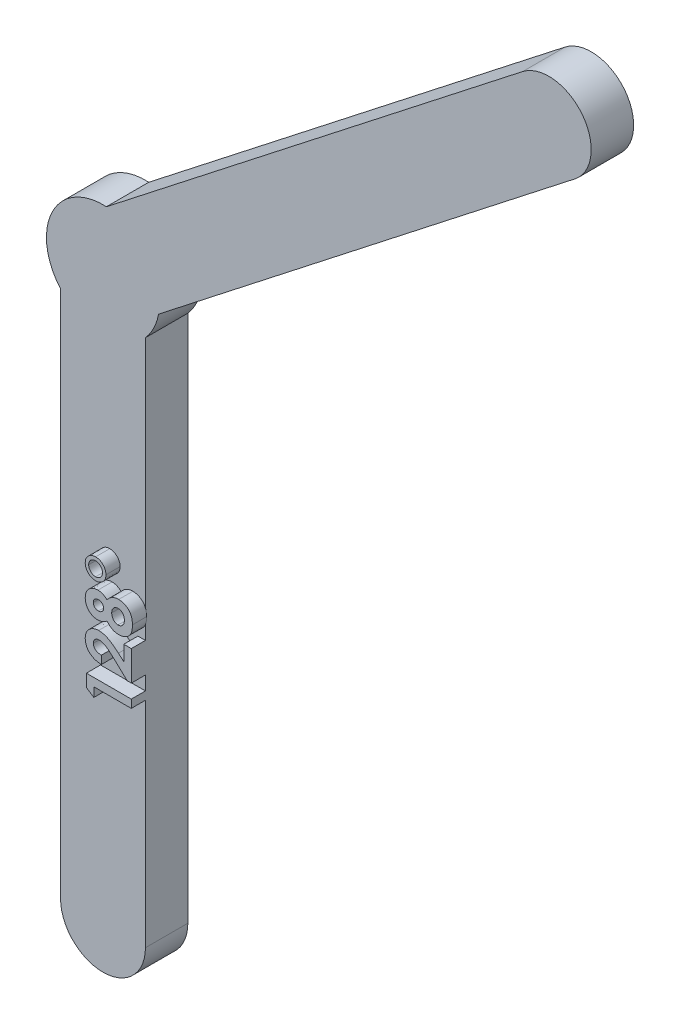
from build123d import *

# Parameters (mm, degrees)
BOSS_EXTRUDE1_DEPTH = 3
BOSS_EXTRUDE2_DEPTH = 1


with BuildPart() as part:
    # Sketch2 → Boss-Extrude1 (new body)
    with BuildSketch(Plane.XY):
        with BuildLine():
            Line((-3, -40), (-3, -2.645751311))
            ThreePointArc((-3, -2.645751311), (-3.595176185, 1.753484587), (0.237896059, 3.992919416))
            Line((0.237896059, 3.992919416), (29.673445718, 26.990491274))
            ThreePointArc((29.673445718, 26.990491274), (33.884462405, 26.473443439), (33.36741457, 22.262426752))
            Line((33.36741457, 22.262426752), (3.93186491, -0.735145105))
            ThreePointArc((3.93186491, -0.735145105), (3.595176185, -1.753484587), (3, -2.645751311))
            Line((3, -2.645751311), (3, -40))
            ThreePointArc((3, -40), (0, -43), (-3, -40))
        make_face()
    extrude(amount=BOSS_EXTRUDE1_DEPTH)

    # Sketch3 → Boss-Extrude2 (add)
    # profile 1 of 4: a face of its own
    with BuildSketch(Plane.XY.offset(3)):
        Polygon((-0.175, -25.154881865), (-0.175, -24.27399745), (3, -24.27399745), (3, -24.843869245), (0.354166667, -24.843869245), (0.354166667, -25.495151297), align=None)
    # profile 2 of 4: a face of its own
    with BuildSketch(Plane.XY.offset(3)):
        with BuildLine():
            Line((0.883333333, -22.645792322), (0.883333333, -23.215664117))
            add(Edge.make_bspline(
                [(0.883333333, -23.215664117), (0.840225096, -23.213203894), (0.755994188, -23.208396767), (0.633653662, -23.189254257), (0.518027034, -23.163669859), (0.40946192, -23.129232627), (0.307912712, -23.086815451), (0.213715784, -23.035362615), (0.126196171, -22.976410318), (0.046888793, -22.908770266), (-0.024410951, -22.835187642), (-0.086743059, -22.755851085), (-0.138923185, -22.670985962), (-0.181726781, -22.581159747), (-0.21597517, -22.486725266), (-0.238860935, -22.386728394), (-0.254362753, -22.28205147), (-0.255719005, -22.210391004), (-0.256410256, -22.173867242)],
                knots=[0, 0, 0, 0, 1.198928049, 2.342633425, 3.435730849, 4.486331048, 5.502589352, 6.488331875, 7.46361919, 8.428949135, 9.378681775, 10.305958057, 11.226249248, 12.140413166, 13.066341608, 14.010670971, 14.986082777, 16, 16, 16, 16], degree=3))
            add(Edge.make_bspline(
                [(-0.256410256, -22.173867242), (-0.255105406, -22.129014709), (-0.252556912, -22.04141358), (-0.227944491, -21.914545291), (-0.1902546, -21.795423218), (-0.135496388, -21.685314483), (-0.066445841, -21.584410522), (0.016045912, -21.493272328), (0.112981004, -21.413677387), (0.22156795, -21.346246446), (0.336775889, -21.290484611), (0.455688105, -21.251034017), (0.575235528, -21.225240195), (0.655723183, -21.222482709), (0.695708133, -21.221112835)],
                knots=[0, 0, 0, 0, 1.075374184, 2.100304875, 3.089917907, 4.066149699, 5.039978333, 6.01615708, 7.006437042, 8.039858286, 9.077679641, 10.07047942, 11.041445745, 12, 12, 12, 12], degree=3))
            add(Edge.make_bspline(
                [(0.695708133, -21.221112835), (0.719894323, -21.221645508), (0.76857515, -21.222717646), (0.842241189, -21.230172364), (0.91727866, -21.241355919), (0.993623236, -21.25821798), (1.071296278, -21.279246402), (1.15053039, -21.304756727), (1.23087573, -21.335341596), (1.313238994, -21.370487076), (1.397877871, -21.412427557), (1.48610119, -21.461212747), (1.57781503, -21.518473646), (1.673918976, -21.582346239), (1.77294563, -21.655343289), (1.875994606, -21.735531175), (1.982903527, -21.82331354), (2.054398515, -21.885567598), (2.091130809, -21.917552138)],
                knots=[0, 0, 0, 0, 0.728277616, 1.465842947, 2.227925269, 3.011838508, 3.818735656, 4.650581052, 5.517389122, 6.406849312, 7.346234817, 8.360743166, 9.441530624, 10.601362564, 11.834937575, 13.145232671, 14.533293658, 16, 16, 16, 16], degree=3))
            Line((2.091130809, -21.917552138), (2.470833333, -22.248917322))
            Line((2.470833333, -22.248917322), (2.470833333, -21.180407707))
            Line((2.470833333, -21.180407707), (3, -21.180407707))
            Line((3, -21.180407707), (3, -23.297074373))
            Line((3, -23.297074373), (2.711247997, -23.297074373))
            Line((2.711247997, -23.297074373), (1.710792268, -22.357040319))
            add(Edge.make_bspline(
                [(1.710792268, -22.357040319), (1.681608954, -22.329823486), (1.625089529, -22.277112553), (1.542079999, -22.202117326), (1.46332294, -22.134228296), (1.38790503, -22.074963449), (1.318379822, -22.020737095), (1.252118997, -21.975372761), (1.190988578, -21.935865985), (1.116473028, -21.894596983), (1.028271209, -21.854503055), (0.9267219, -21.817737564), (0.829596088, -21.795551101), (0.766193513, -21.79246509), (0.735777244, -21.79098463)],
                knots=[0, 0, 0, 0, 1.246192343, 2.413505005, 3.49357156, 4.492416076, 5.408771964, 6.246246772, 6.999304986, 7.680960093, 8.904522682, 10.020616941, 11.0504258, 12, 12, 12, 12], degree=3))
            add(Edge.make_bspline(
                [(0.735777244, -21.79098463), (0.706350798, -21.792088613), (0.649332342, -21.794227757), (0.568223891, -21.817735215), (0.494788469, -21.854153784), (0.431220409, -21.905472692), (0.378982318, -21.967635962), (0.340129094, -22.039471459), (0.317710962, -22.120393514), (0.314905012, -22.177121417), (0.313461538, -22.206304141)],
                knots=[0, 0, 0, 0, 1.062038974, 2.057870785, 3.028805853, 4.01125022, 4.991535629, 5.949134679, 6.94496649, 8, 8, 8, 8], degree=3))
            add(Edge.make_bspline(
                [(0.313461538, -22.206304141), (0.313994775, -22.221380308), (0.315044537, -22.251060165), (0.322032517, -22.294687234), (0.334348102, -22.336201524), (0.350849253, -22.376065113), (0.372721647, -22.413852566), (0.399682857, -22.449468572), (0.431047738, -22.483288388), (0.466718216, -22.515156906), (0.50652648, -22.544161417), (0.550108963, -22.569923117), (0.597438611, -22.591223755), (0.647890602, -22.609977611), (0.70200683, -22.624441481), (0.759463417, -22.634972974), (0.820166887, -22.642979364), (0.861894815, -22.644837612), (0.883333333, -22.645792322)],
                knots=[0, 0, 0, 0, 0.903469896, 1.778625579, 2.63899355, 3.493148037, 4.358286772, 5.247621495, 6.164656832, 7.118446693, 8.109501108, 9.111810964, 10.146451449, 11.215617525, 12.33435995, 13.498009769, 14.714554818, 16, 16, 16, 16], degree=3))
        make_face()
    # profile 3 of 4: a face of its own
    with BuildSketch(Plane.XY.offset(3)):
        with BuildLine():
            add(Edge.make_bspline(
                [(1.290384615, -19.051020688), (1.314166509, -19.017717364), (1.361240621, -18.951796441), (1.445595377, -18.865020774), (1.539140341, -18.789616624), (1.642399085, -18.727763317), (1.752431528, -18.677802774), (1.868089089, -18.642445048), (1.988052111, -18.619686169), (2.069615292, -18.617227529), (2.110847356, -18.61598463)],
                knots=[0, 0, 0, 0, 1.013621193, 2.006371702, 2.99000395, 3.985409788, 4.983103806, 5.979189713, 6.978433935, 8, 8, 8, 8], degree=3))
            add(Edge.make_bspline(
                [(2.110847356, -18.61598463), (2.155493061, -18.617489887), (2.244042089, -18.620475373), (2.373883227, -18.646936752), (2.498505826, -18.689197465), (2.616432852, -18.747499154), (2.724431839, -18.820252379), (2.820760825, -18.904585334), (2.901500204, -19.001764288), (2.956541404, -19.091887492), (2.992613836, -19.169755283), (3.017147677, -19.231991917), (3.036374539, -19.298589566), (3.053202037, -19.368555769), (3.065563353, -19.442765144), (3.075401317, -19.520595177), (3.080155908, -19.602600638), (3.08098502, -19.658413081), (3.081410256, -19.687038316)],
                knots=[0, 0, 0, 0, 1.313695232, 2.605545886, 3.885009818, 5.18064216, 6.467307036, 7.710187626, 8.938110693, 10.173834898, 10.807905002, 11.46418112, 12.141763502, 12.847499418, 13.582459421, 14.356129027, 15.156887083, 16, 16, 16, 16], degree=3))
            add(Edge.make_bspline(
                [(3.081410256, -19.687038316), (3.080993787, -19.717572186), (3.080180505, -19.777198813), (3.075321583, -19.864249357), (3.066194522, -19.946330762), (3.054699341, -20.02380978), (3.037672832, -20.095993684), (3.018972292, -20.163971967), (2.996206942, -20.227019384), (2.960636755, -20.303731559), (2.907185797, -20.392201597), (2.828023569, -20.487079082), (2.734597618, -20.571413966), (2.627697323, -20.643222676), (2.509788283, -20.701139127), (2.383511061, -20.7435029), (2.249446964, -20.768783032), (2.157597072, -20.771813817), (2.110847356, -20.773356425)],
                knots=[0, 0, 0, 0, 0.887120363, 1.732371145, 2.531576131, 3.285973923, 4.006155245, 4.684676743, 5.333503306, 5.950809733, 7.13915648, 8.324434623, 9.528022799, 10.783613014, 12.053458699, 13.333110172, 14.642607612, 16, 16, 16, 16], degree=3))
            add(Edge.make_bspline(
                [(2.110847356, -20.773356425), (2.070068436, -20.771941537), (1.989932921, -20.769161112), (1.872494733, -20.749302816), (1.761018818, -20.715036361), (1.654672452, -20.668536346), (1.553870674, -20.608226402), (1.459741575, -20.533585913), (1.370281849, -20.446635831), (1.317458785, -20.380490844), (1.290384615, -20.346588596)],
                knots=[0, 0, 0, 0, 1.018125035, 2.000738969, 2.963689272, 3.92372463, 4.892478514, 5.887985778, 6.917498794, 8, 8, 8, 8], degree=3))
            add(Edge.make_bspline(
                [(1.290384615, -20.346588596), (1.266151716, -20.367602223), (1.218444435, -20.408971725), (1.141646952, -20.462470619), (1.062364505, -20.507765328), (0.981097768, -20.545733804), (0.89711666, -20.574089031), (0.811521784, -20.59566383), (0.723184578, -20.607674163), (0.663516636, -20.609575532), (0.633378405, -20.610535912)],
                knots=[0, 0, 0, 0, 1.061588578, 2.089948196, 3.093099862, 4.082597858, 5.055037947, 6.023898163, 7.001872498, 8, 8, 8, 8], degree=3))
            add(Edge.make_bspline(
                [(0.633378405, -20.610535912), (0.592576327, -20.609275809), (0.512075397, -20.606789674), (0.394207452, -20.584507411), (0.28205246, -20.548021589), (0.176290436, -20.497791994), (0.079075037, -20.434587856), (-0.007396026, -20.358443966), (-0.081993722, -20.270641334), (-0.145475268, -20.172328027), (-0.195029291, -20.063625405), (-0.230531324, -19.946207535), (-0.252811348, -19.820808736), (-0.25519237, -19.734410725), (-0.256410256, -19.690218404)],
                knots=[0, 0, 0, 0, 1.02226196, 2.016883474, 2.9952073, 3.972418565, 4.944004294, 5.893096802, 6.850754418, 7.823909284, 8.818133006, 9.835407617, 10.892817559, 12, 12, 12, 12], degree=3))
            add(Edge.make_bspline(
                [(-0.256410256, -19.690218404), (-0.255190422, -19.646662662), (-0.252812, -19.561738085), (-0.230679106, -19.438541783), (-0.194395909, -19.323670332), (-0.143773179, -19.217368046), (-0.08015754, -19.120077541), (-0.003012872, -19.033777327), (0.085649386, -18.957869341), (0.185372183, -18.894140442), (0.292865784, -18.842893718), (0.405795355, -18.805448662), (0.522920147, -18.783490726), (0.602336048, -18.780373249), (0.642282652, -18.778805143)],
                knots=[0, 0, 0, 0, 1.094451292, 2.133950859, 3.135435022, 4.115505557, 5.085475983, 6.048403322, 7.01637925, 8.011600517, 9.015508126, 10.003420448, 10.995710276, 12, 12, 12, 12], degree=3))
            add(Edge.make_bspline(
                [(0.642282652, -18.778805143), (0.670513068, -18.779563838), (0.725913147, -18.78105272), (0.807533099, -18.792061213), (0.885847553, -18.810598164), (0.962749047, -18.836442872), (1.040327423, -18.872375838), (1.120069223, -18.921001495), (1.205287736, -18.980148223), (1.261061511, -19.026599103), (1.290384615, -19.051020688)],
                knots=[0, 0, 0, 0, 0.940746401, 1.846144481, 2.739104268, 3.619506754, 4.545839139, 5.581956076, 6.728711598, 8, 8, 8, 8], degree=3))
        make_face()
        with BuildLine():
            add(Edge.make_bspline(
                [(0.313461538, -19.704210792), (0.314577296, -19.727681709), (0.316747691, -19.773337828), (0.336791099, -19.838249913), (0.368396801, -19.897141705), (0.413289247, -19.947823253), (0.468001453, -19.988958984), (0.530415435, -20.019695609), (0.600152328, -20.03775339), (0.648960581, -20.039675008), (0.674083534, -20.040664117)],
                knots=[0, 0, 0, 0, 1.01773081, 1.979711282, 2.923920718, 3.903393177, 4.896680191, 5.881555186, 6.909578104, 8, 8, 8, 8], degree=3))
            add(Edge.make_bspline(
                [(0.674083534, -20.040664117), (0.699424417, -20.03944688), (0.748904934, -20.037070107), (0.819934691, -20.018349127), (0.884396564, -19.986516514), (0.940626067, -19.942450413), (0.987659679, -19.889931078), (1.021570733, -19.829582595), (1.04308292, -19.763530046), (1.045116089, -19.717098031), (1.046153846, -19.693398492)],
                knots=[0, 0, 0, 0, 1.070748338, 2.090739333, 3.08117878, 4.090911184, 5.094654374, 6.042199979, 7.000711936, 8, 8, 8, 8], degree=3))
            add(Edge.make_bspline(
                [(1.046153846, -19.693398492), (1.045059816, -19.669297424), (1.042928441, -19.622344023), (1.022508887, -19.555369246), (0.988689983, -19.495573894), (0.94229789, -19.444111814), (0.886359471, -19.401065933), (0.820898298, -19.370216145), (0.747532717, -19.352293405), (0.696233661, -19.349911913), (0.66963141, -19.348676938)],
                knots=[0, 0, 0, 0, 1.009150293, 1.966014103, 2.906107826, 3.870180916, 4.854078599, 5.848854597, 6.884476363, 8, 8, 8, 8], degree=3))
            add(Edge.make_bspline(
                [(0.66963141, -19.348676938), (0.644523092, -19.349946247), (0.595964488, -19.352401046), (0.526250213, -19.370002897), (0.464864053, -19.402329577), (0.410961323, -19.444802663), (0.367492124, -19.498052531), (0.335524613, -19.559871727), (0.316983147, -19.629805041), (0.314660828, -19.678871787), (0.313461538, -19.704210792)],
                knots=[0, 0, 0, 0, 1.065910571, 2.061433587, 3.023559535, 3.990682701, 4.956464619, 5.918590567, 6.925120432, 8, 8, 8, 8], degree=3))
        make_face(mode=Mode.SUBTRACT)
        with BuildLine():
            add(Edge.make_bspline(
                [(1.616025641, -19.685766281), (1.616315036, -19.703598422), (1.616885429, -19.73874535), (1.623711201, -19.790376643), (1.633401384, -19.840126914), (1.648498508, -19.88712446), (1.666134775, -19.932614345), (1.689165374, -19.975448281), (1.715918448, -20.016360178), (1.74640318, -20.054467234), (1.779830517, -20.088917867), (1.814702344, -20.119969165), (1.851910211, -20.14534988), (1.890219827, -20.166485794), (1.929934133, -20.183468663), (1.971707306, -20.194695613), (2.014983002, -20.2019242), (2.044460653, -20.202961427), (2.059329928, -20.20348463)],
                knots=[0, 0, 0, 0, 1.129662435, 2.226550525, 3.296682235, 4.33815786, 5.351414921, 6.385493299, 7.41431807, 8.4469981, 9.473537958, 10.454642902, 11.401552439, 12.321859429, 13.225429467, 14.131893492, 15.057679712, 16, 16, 16, 16], degree=3))
            add(Edge.make_bspline(
                [(2.059329928, -20.20348463), (2.074837113, -20.203235262), (2.105593696, -20.202740671), (2.150485415, -20.195270575), (2.193780386, -20.184514952), (2.235073386, -20.16940835), (2.274340207, -20.149206087), (2.311963245, -20.125084417), (2.347676229, -20.096201288), (2.381297203, -20.063343471), (2.411600958, -20.026547989), (2.438404735, -19.986932473), (2.461677906, -19.944755121), (2.479861546, -19.899615267), (2.49411916, -19.851691996), (2.503888336, -19.801193441), (2.510720881, -19.74785651), (2.511261264, -19.711441894), (2.511538462, -19.692762474)],
                knots=[0, 0, 0, 0, 0.973751152, 1.931314908, 2.852573969, 3.776047714, 4.688004804, 5.623328242, 6.580799242, 7.570383313, 8.573782212, 9.57185612, 10.573837789, 11.596003268, 12.62492379, 13.712263769, 14.826471634, 16, 16, 16, 16], degree=3))
            add(Edge.make_bspline(
                [(2.511538462, -19.692762474), (2.511196157, -19.673878018), (2.510529115, -19.637078193), (2.504633754, -19.583284228), (2.495279457, -19.532404762), (2.481900889, -19.484500212), (2.464761533, -19.439390689), (2.442949692, -19.397676758), (2.418219634, -19.358422595), (2.389368786, -19.322829552), (2.357892778, -19.290618983), (2.323956282, -19.262238093), (2.287463312, -19.238478497), (2.248401199, -19.219596335), (2.207627439, -19.204064059), (2.164524234, -19.193264276), (2.119106345, -19.186745793), (2.087973171, -19.18615737), (2.07205028, -19.185856425)],
                knots=[0, 0, 0, 0, 1.200550576, 2.339492856, 3.436821733, 4.486835684, 5.498320788, 6.499238723, 7.475334368, 8.44385928, 9.406737867, 10.335409062, 11.251568017, 12.168024507, 13.089524389, 14.021419298, 14.988065767, 16, 16, 16, 16], degree=3))
            add(Edge.make_bspline(
                [(2.07205028, -19.185856425), (2.056133401, -19.186438247), (2.025021417, -19.187575509), (1.979077259, -19.19379844), (1.935521469, -19.205472018), (1.893343926, -19.220744483), (1.853417246, -19.24106031), (1.81582637, -19.266282191), (1.779637539, -19.294990049), (1.746471676, -19.328546456), (1.716116677, -19.365222977), (1.689182565, -19.404304091), (1.666011589, -19.445389594), (1.64851655, -19.489488572), (1.633396343, -19.535201471), (1.62371115, -19.583692682), (1.616884013, -19.634054263), (1.616314611, -19.668357483), (1.616025641, -19.685766281)],
                knots=[0, 0, 0, 0, 1.011783362, 1.977685852, 2.938313235, 3.871729441, 4.823627117, 5.776382316, 6.744161804, 7.753880392, 8.768082256, 9.765777265, 10.766741032, 11.757408326, 12.775628261, 13.821889533, 14.89461443, 16, 16, 16, 16], degree=3))
        make_face(mode=Mode.SUBTRACT)
    # profile 4 of 4: a face of its own
    with BuildSketch(Plane.XY.offset(3)):
        with BuildLine():
            add(Edge.make_bspline(
                [(0.476282051, -16.824958989), (0.501543872, -16.825505484), (0.55122174, -16.826580176), (0.624352745, -16.837013476), (0.694208258, -16.854492691), (0.761803607, -16.876903338), (0.825395964, -16.908042089), (0.886396731, -16.944903837), (0.943669883, -16.989402672), (0.9978957, -17.039014969), (1.047295391, -17.093515132), (1.090947065, -17.151405488), (1.127096601, -17.212864468), (1.157366856, -17.276577248), (1.180332148, -17.343408663), (1.196689885, -17.412864586), (1.20741609, -17.485236986), (1.208449037, -17.534503871), (1.208974359, -17.559559349)],
                knots=[0, 0, 0, 0, 1.048753193, 2.062393874, 3.059725798, 4.03711221, 5.013824111, 5.993903926, 6.992478922, 8.020738441, 9.043061753, 10.043343452, 11.026424807, 11.999358773, 12.968420071, 13.955122655, 14.960044262, 16, 16, 16, 16], degree=3))
            add(Edge.make_bspline(
                [(1.208974359, -17.559559349), (1.208454225, -17.584616682), (1.207431478, -17.633887214), (1.196631189, -17.706233128), (1.180530583, -17.775855144), (1.156529218, -17.842391691), (1.126678292, -17.90615653), (1.090260147, -17.967072817), (1.046482503, -18.024600993), (0.996781055, -18.078582797), (0.942375086, -18.128107638), (0.88420218, -18.171482912), (0.823225465, -18.208946116), (0.758107997, -18.237837437), (0.69067286, -18.261947038), (0.619758864, -18.27798784), (0.545943315, -18.288833106), (0.495615647, -18.289833085), (0.469921875, -18.290343604)],
                knots=[0, 0, 0, 0, 1.037227242, 2.039512271, 3.023626077, 3.993053151, 4.963434463, 5.936395473, 6.927031705, 7.952593414, 8.972234493, 9.969891786, 10.954906455, 11.929570282, 12.915563215, 13.916770353, 14.936449251, 16, 16, 16, 16], degree=3))
            add(Edge.make_bspline(
                [(0.469921875, -18.290343604), (0.445290866, -18.289811451), (0.396869022, -18.288765297), (0.325492116, -18.278103661), (0.256787066, -18.261182775), (0.190979117, -18.23681523), (0.128167681, -18.205730248), (0.067236284, -18.169180135), (0.010175979, -18.123937412), (-0.044275745, -18.073515722), (-0.093962638, -18.018218509), (-0.137555056, -17.95952238), (-0.173973759, -17.89802202), (-0.203993097, -17.834134423), (-0.227847104, -17.767768562), (-0.244158222, -17.698411219), (-0.254789074, -17.626671533), (-0.255866772, -17.577830012), (-0.256410256, -17.553199173)],
                knots=[0, 0, 0, 0, 1.027628768, 2.020204677, 3.0054932, 3.977172113, 4.942988595, 5.928118098, 6.937247537, 7.976812879, 9.023474825, 10.036014018, 11.024160528, 12.002107364, 12.979092523, 13.962271943, 14.972371232, 16, 16, 16, 16], degree=3))
            add(Edge.make_bspline(
                [(-0.256410256, -17.553199173), (-0.255881051, -17.528566172), (-0.254836181, -17.479930408), (-0.244068832, -17.408427146), (-0.227959354, -17.339440503), (-0.203981879, -17.27352423), (-0.173948227, -17.210285117), (-0.137706982, -17.149501332), (-0.093944483, -17.091941849), (-0.043999627, -17.038019265), (0.009956511, -16.987787182), (0.068273488, -16.944627592), (0.128824771, -16.907104674), (0.192846684, -16.877455064), (0.259342082, -16.853394895), (0.329176204, -16.837233977), (0.401748506, -16.826543556), (0.451226198, -16.825491671), (0.476282051, -16.824958989)],
                knots=[0, 0, 0, 0, 1.02774298, 2.029191086, 3.012479778, 3.981238486, 4.951290381, 5.931946007, 6.930416638, 7.964088953, 8.997761269, 10.003308488, 10.98854748, 11.966603007, 12.943696749, 13.935593372, 14.954569896, 16, 16, 16, 16], degree=3))
        make_face()
        with BuildLine():
            add(Edge.make_bspline(
                [(0.479462139, -17.069189758), (0.462471258, -17.069424264), (0.428972226, -17.069886612), (0.379883793, -17.077505977), (0.332524379, -17.088023775), (0.287283463, -17.10328392), (0.24427911, -17.123234284), (0.203398935, -17.147571829), (0.164484674, -17.176174899), (0.128492582, -17.209237523), (0.095853701, -17.245103846), (0.066652511, -17.282897251), (0.042455186, -17.323086522), (0.023016589, -17.365273093), (0.006315159, -17.408801858), (-0.003707976, -17.454711924), (-0.01154919, -17.502263298), (-0.011966436, -17.534718897), (-0.012179487, -17.55129112)],
                knots=[0, 0, 0, 0, 1.061159961, 2.092171217, 3.098605391, 4.092036902, 5.070589041, 6.057187883, 7.061962211, 8.084674938, 9.107387665, 10.090954379, 11.06617917, 12.032717429, 12.99305519, 13.973669989, 14.965331307, 16, 16, 16, 16], degree=3))
            add(Edge.make_bspline(
                [(-0.012179487, -17.55129112), (-0.01157068, -17.568051412), (-0.01036426, -17.601263796), (-0.004409395, -17.650200831), (0.007572839, -17.69685371), (0.022606002, -17.742054962), (0.043122897, -17.784898142), (0.067542797, -17.826391236), (0.096744971, -17.865435361), (0.129769422, -17.902214665), (0.165718261, -17.935960463), (0.204573602, -17.964950546), (0.244977971, -17.990352408), (0.287582445, -18.010455361), (0.331832846, -18.026567734), (0.377821945, -18.038209426), (0.425871214, -18.044356322), (0.458458137, -18.045521173), (0.475010016, -18.046112835)],
                knots=[0, 0, 0, 0, 1.042034071, 2.064906527, 3.055369705, 4.030203466, 5.020228521, 6.000742353, 7.017744738, 8.043920206, 9.069249762, 10.075703201, 11.051782302, 12.029903876, 12.99669358, 13.974371501, 14.971122288, 16, 16, 16, 16], degree=3))
            add(Edge.make_bspline(
                [(0.475010016, -18.046112835), (0.491349767, -18.045520146), (0.523514051, -18.044353455), (0.570936909, -18.038223162), (0.616468237, -18.026465839), (0.660506807, -18.010425399), (0.703332854, -17.990458383), (0.743356347, -17.964229259), (0.782721478, -17.935019181), (0.819574977, -17.900938323), (0.853594861, -17.864058718), (0.883277913, -17.824563201), (0.908722399, -17.783622403), (0.929101491, -17.740636346), (0.945194342, -17.696373754), (0.956841315, -17.650387952), (0.962986781, -17.60233779), (0.964151827, -17.56975099), (0.96474359, -17.553199173)],
                knots=[0, 0, 0, 0, 1.017878107, 2.003660885, 2.970612419, 3.939454555, 4.919652619, 5.904816436, 6.913406512, 7.969270601, 9.02513469, 10.033724766, 11.041277553, 12.021475617, 12.990317753, 13.970071221, 14.968938047, 16, 16, 16, 16], degree=3))
            add(Edge.make_bspline(
                [(0.96474359, -17.553199173), (0.964515736, -17.536840687), (0.964066668, -17.504600367), (0.956359019, -17.457448889), (0.946146284, -17.411789288), (0.929505189, -17.368485652), (0.910263551, -17.326033898), (0.884925795, -17.286252494), (0.856415485, -17.247396305), (0.822504018, -17.212069657), (0.787116244, -17.177952839), (0.747777121, -17.149765554), (0.707718654, -17.124520148), (0.665616684, -17.10387006), (0.621397497, -17.089062601), (0.575848465, -17.07693948), (0.528165265, -17.071009446), (0.49579822, -17.069800121), (0.479462139, -17.069189758)],
                knots=[0, 0, 0, 0, 1.029744634, 2.029484694, 3.00508751, 3.97324883, 4.947661161, 5.937798898, 6.940036528, 7.980134083, 9.020231638, 10.033191535, 11.023329272, 12.003497406, 12.979740652, 13.958541426, 14.969648588, 16, 16, 16, 16], degree=3))
        make_face(mode=Mode.SUBTRACT)
    extrude(amount=BOSS_EXTRUDE2_DEPTH)


solid = part.part
